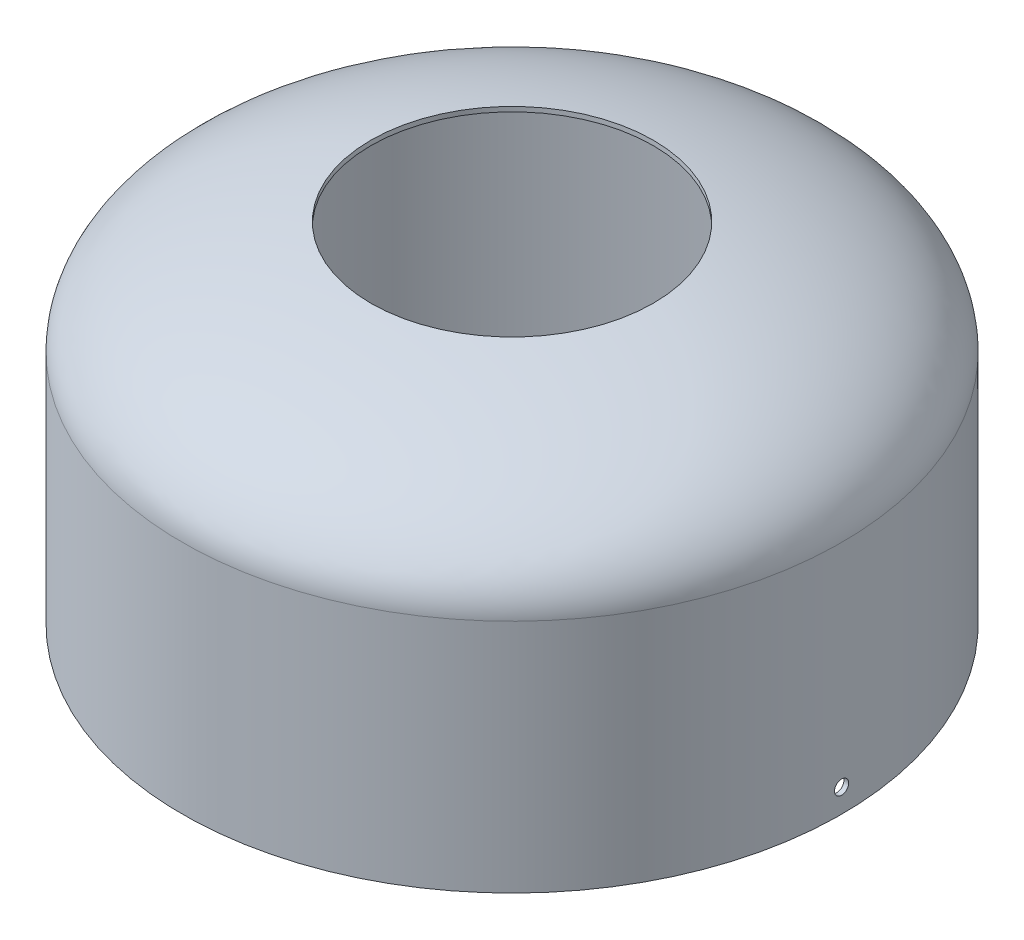
from build123d import *

# Parameters (mm, degrees)
CUT_EXTRUDE1_DEPTH      = 282.699627389
CUT_EXTRUDE1_DEPTH_BACK = 282.699627389
SKETCH2_R               = 3.81


with BuildPart() as part:
    # Sketch1 → Revolve1 (revolve)
    with BuildSketch(Plane.XY):
        with BuildLine():
            Line((175.26, -127), (175.26, 0))
            add(Edge.make_bspline(
                [(175.26, 0), (175.26, 40.716969697), (76.2, 58.42)],
                knots=[0, 0, 0, 1.120999466, 1.120999466, 1.120999466], degree=2, weights=[1, 0.846989554, 1]))
            Line((76.2, 58.42), (76.2, 60.96))
            add(Edge.make_bspline(
                [(177.8, 0), (177.8, 42.672), (76.2, 60.96)],
                knots=[0, 0, 0, 1.127885283, 1.127885283, 1.127885283], degree=2, weights=[1, 0.845154255, 1]))
            Line((177.8, 0), (177.8, -127))
            Line((177.8, -127), (175.26, -127))
        make_face()
    revolve(axis=Axis((0, -109.728, 0), (0, 1, 0)))

    # Sketch2 → Cut-Extrude1 (cut, two sides: drawn at the far end of the back side and taken through both)
    with BuildSketch(Plane(origin=(0, 0, 0), x_dir=(0, 0, -1), z_dir=(1, 0, 0)).offset(-CUT_EXTRUDE1_DEPTH_BACK)):
        with Locations((0, -114.3)):
            Circle(SKETCH2_R)
    extrude(amount=CUT_EXTRUDE1_DEPTH + CUT_EXTRUDE1_DEPTH_BACK, mode=Mode.SUBTRACT)


solid = part.part
